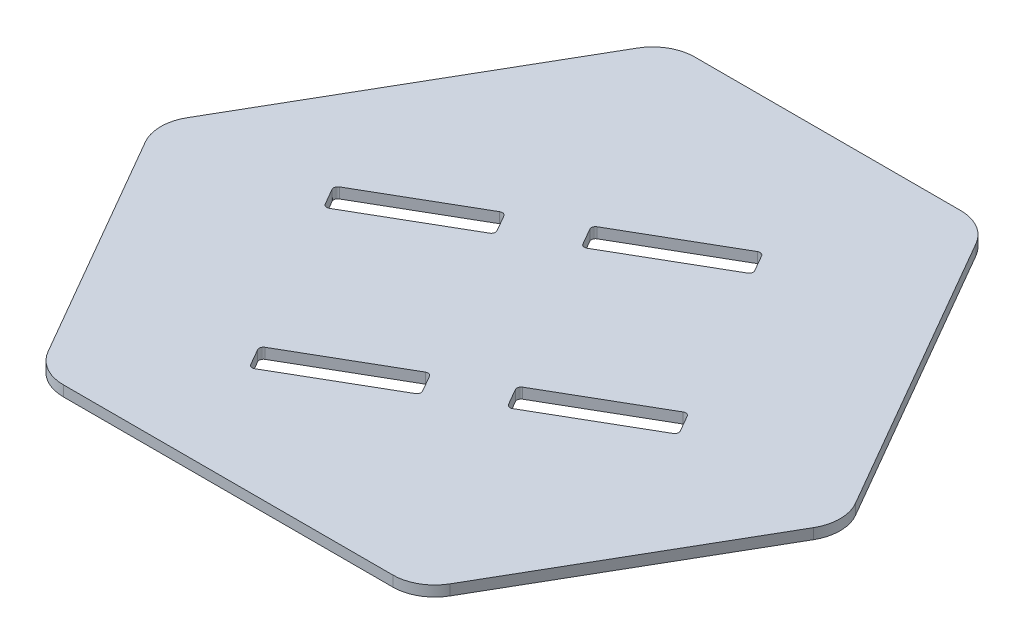
from build123d import *

# Parameters (mm, degrees)
EXTRUDE_1_DEPTH     = 5
FILLET_1_R          = 20
CUT_EXTRUDE_1_DEPTH = 10
FILLET_2_R          = 2


with BuildPart() as part:
    # 草圖1 → 填料-伸長1 (new body)
    with BuildSketch(Plane(origin=(0, 0, 0), x_dir=(1, 0, 0), z_dir=(0, 1, 0))):
        Polygon((-90.122176988, 0), (90.122176988, 0), (165.122176988, 129.903810568), (75, 286), (-75, 286), (-165.122176988, 129.903810568), align=None)
    extrude(amount=EXTRUDE_1_DEPTH)

    # 圓角1
    fillet_1_edges = [part.edges().sort_by_distance(p)[0] for p in [
        (-165.122176988, 2.5, -129.903810568),
        (-75, 2.5, -286),
        (75, 2.5, -286),
        (165.122176988, 2.5, -129.903810568),
        (90.122176988, 2.5, 0),
        (-90.122176988, 2.5, 0),
    ]]
    fillet(fillet_1_edges, radius=FILLET_1_R)

    # 草圖2 → 除料-伸長1 (cut)
    with BuildSketch(Plane(origin=(0, 5, 0), x_dir=(1, 0, 0), z_dir=(0, 1, 0))):
        Polygon((-11.79016319, 180.324972243), (40.171361037, 210.324972243), (33.671361037, 221.583302492), (-18.29016319, 191.583302492), align=None)
        Polygon((-44.270925304, 176.583302492), (-37.770925304, 165.324972243), (-89.732449531, 135.324972243), (-96.232449531, 146.583302492), align=None)
        Polygon((4.229074696, 92.578838325), (-47.732449531, 62.578838325), (-41.232449531, 51.320508076), (10.729074696, 81.320508076), align=None)
        Polygon((36.70983681, 96.320508076), (30.20983681, 107.578838325), (82.171361037, 137.578838325), (88.671361037, 126.320508076), align=None)
    extrude(amount=-CUT_EXTRUDE_1_DEPTH, mode=Mode.SUBTRACT)

    # 圓角2
    fillet_2_edges = [part.edges().sort_by_distance(p)[0] for p in [
        (88.671361037, 2.5, -126.320508076),
        (36.70983681, 2.5, -96.320508076),
        (30.20983681, 2.5, -107.578838325),
        (82.171361037, 2.5, -137.578838325),
        (-11.79016319, 2.5, -180.324972243),
        (-18.29016319, 2.5, -191.583302492),
        (33.671361037, 2.5, -221.583302492),
        (40.171361037, 2.5, -210.324972243),
        (-96.232449531, 2.5, -146.583302492),
        (-44.270925304, 2.5, -176.583302492),
        (-37.770925304, 2.5, -165.324972243),
        (-89.732449531, 2.5, -135.324972243),
        (4.229074696, 2.5, -92.578838325),
        (10.729074696, 2.5, -81.320508076),
        (-41.232449531, 2.5, -51.320508076),
        (-47.732449531, 2.5, -62.578838325),
    ]]
    fillet(fillet_2_edges, radius=FILLET_2_R)


solid = part.part
